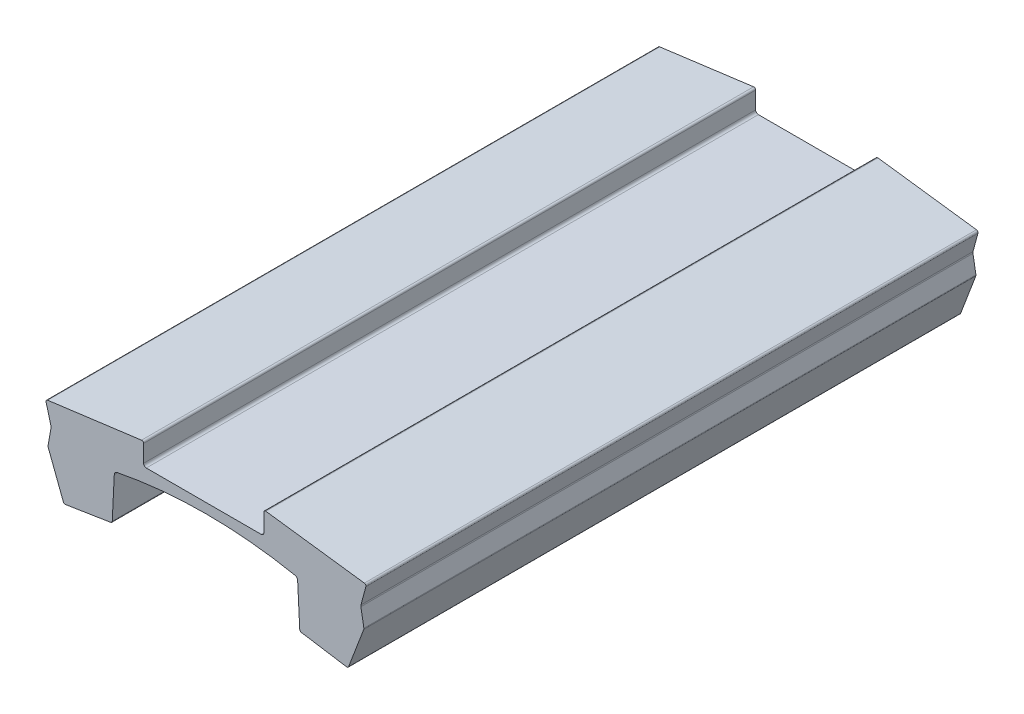
from build123d import *

# Parameters (mm, degrees)
BOSS_EXTRUDE2_DEPTH = 67.5


with BuildPart() as part:
    # Sketch1 → Boss-Extrude2 (new body)
    with BuildSketch(Plane.XY):
        with BuildLine():
            Line((-17.624839098, 90.556097537), (-17.081964944, 88.53006361))
            ThreePointArc((-17.081964944, 88.53006361), (-17.06872461, 88.444180172), (-17.07434408, 88.357464009))
            Line((-17.07434408, 88.357464009), (-17.406101009, 86.465100374))
            ThreePointArc((-17.406101009, 86.465100374), (-17.408194108, 86.4114937), (-17.395962494, 86.359259189))
            Line((-17.395962494, 86.359259189), (-15.714560006, 81.953100992))
            ThreePointArc((-15.714560006, 81.953100992), (-15.62787368, 81.851299803), (-15.496416031, 81.826868517))
            Line((-15.496416031, 81.826868517), (-10.495838808, 82.618882142))
            ThreePointArc((-10.495838808, 82.618882142), (-10.378300643, 82.682811793), (-10.327369953, 82.806538448))
            Line((-10.327369953, 82.806538448), (-10.101894168, 87.364622968))
            ThreePointArc((-10.101894168, 87.364622968), (-10.0050052, 87.606431661), (-9.779768503, 87.737303149))
            ThreePointArc((-9.779768503, 87.737303149), (0.009655574, 88.693275712), (9.799075243, 87.737258013))
            ThreePointArc((9.799075243, 87.737258013), (10.024185058, 87.606531513), (10.121179929, 87.364961975))
            Line((10.121179929, 87.364961975), (10.351109341, 82.805609758))
            ThreePointArc((10.351109341, 82.805609758), (10.40209464, 82.682003526), (10.519568611, 82.618145345))
            Line((10.519568611, 82.618145345), (15.520145834, 81.82613172))
            ThreePointArc((15.520145834, 81.82613172), (15.65168662, 81.850611141), (15.738358224, 81.952543733))
            Line((15.738358224, 81.952543733), (17.415135527, 86.359286022))
            ThreePointArc((17.415135527, 86.359286022), (17.427307864, 86.411436625), (17.425205627, 86.464947668))
            Line((17.425205627, 86.464947668), (17.093421927, 88.357464009))
            ThreePointArc((17.093421927, 88.357464009), (17.087802457, 88.444180172), (17.101042791, 88.53006361))
            Line((17.101042791, 88.53006361), (17.643916946, 90.556097537))
            ThreePointArc((17.643916946, 90.556097537), (17.617025703, 90.718975393), (17.476837019, 90.806150319))
            Line((17.476837019, 90.806150319), (6.615644162, 92.236053485))
            ThreePointArc((6.615644162, 92.236053485), (6.457669761, 92.188132474), (6.389538924, 92.037764513))
            Line((6.389538924, 92.037764513), (6.389538924, 90.07390614))
            ThreePointArc((6.389538924, 90.07390614), (6.301670958, 89.861774106), (6.089538924, 89.77390614))
            Line((6.089538924, 89.77390614), (-6.570461076, 89.77390614))
            ThreePointArc((-6.570461076, 89.77390614), (-6.782593111, 89.861774106), (-6.870461076, 90.07390614))
            Line((-6.870461076, 90.07390614), (-6.870461076, 91.971938264))
            ThreePointArc((-6.870461076, 91.971938264), (-6.938591913, 92.122306225), (-7.096566315, 92.170227236))
            Line((-7.096566315, 92.170227236), (-17.457759172, 90.806150319))
            ThreePointArc((-17.457759172, 90.806150319), (-17.597947856, 90.718975393), (-17.624839098, 90.556097537))
        make_face()
    extrude(amount=BOSS_EXTRUDE2_DEPTH)


solid = part.part
